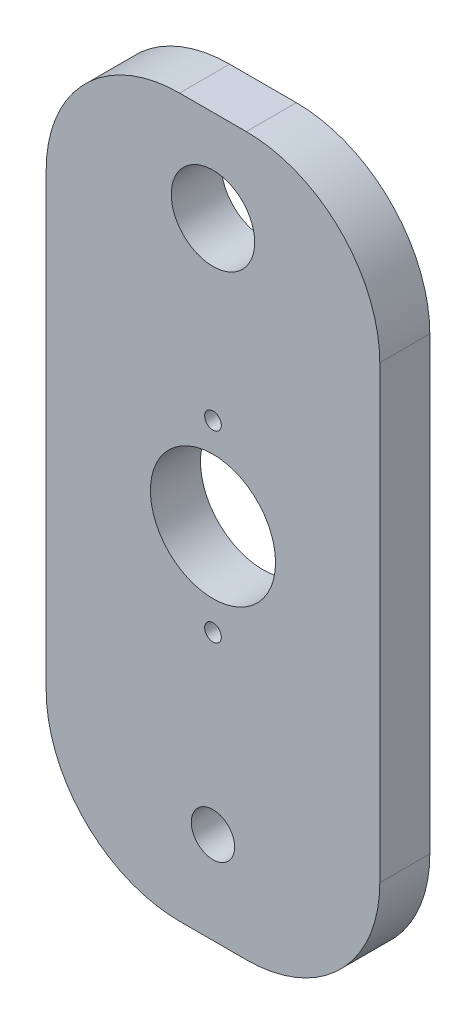
from build123d import *

# Parameters (mm, degrees)
SCHIZZO2_R    = 37.5
SCHIZZO2_R_2  = 13
SCHIZZO2_R_3  = 25
SCHIZZO2_R_4  = 5
PIASTRA_DEPTH = 30


with BuildPart() as part:
    # Schizzo2 → Piastra (new body)
    with BuildSketch(Plane.XY):
        with BuildLine():
            Line((20, 215), (-20, 215))
            ThreePointArc((-20, 215), (-76.568542495, 191.568542495), (-100, 135))
            Line((-100, 135), (-100, -135))
            ThreePointArc((-100, -135), (-76.568542495, -191.568542495), (-20, -215))
            Line((-20, -215), (20, -215))
            ThreePointArc((20, -215), (76.568542495, -191.568542495), (100, -135))
            Line((100, -135), (100, 135))
            ThreePointArc((100, 135), (76.568542495, 191.568542495), (20, 215))
        make_face()
        Circle(SCHIZZO2_R, mode=Mode.SUBTRACT)
        with Locations((0, -160)):
            Circle(SCHIZZO2_R_2, mode=Mode.SUBTRACT)
        with Locations((0, 160)):
            Circle(SCHIZZO2_R_3, mode=Mode.SUBTRACT)
        with Locations((0, 55)):
            Circle(SCHIZZO2_R_4, mode=Mode.SUBTRACT)
        with Locations((0, -55)):
            Circle(SCHIZZO2_R_4, mode=Mode.SUBTRACT)
    extrude(amount=PIASTRA_DEPTH)


solid = part.part
